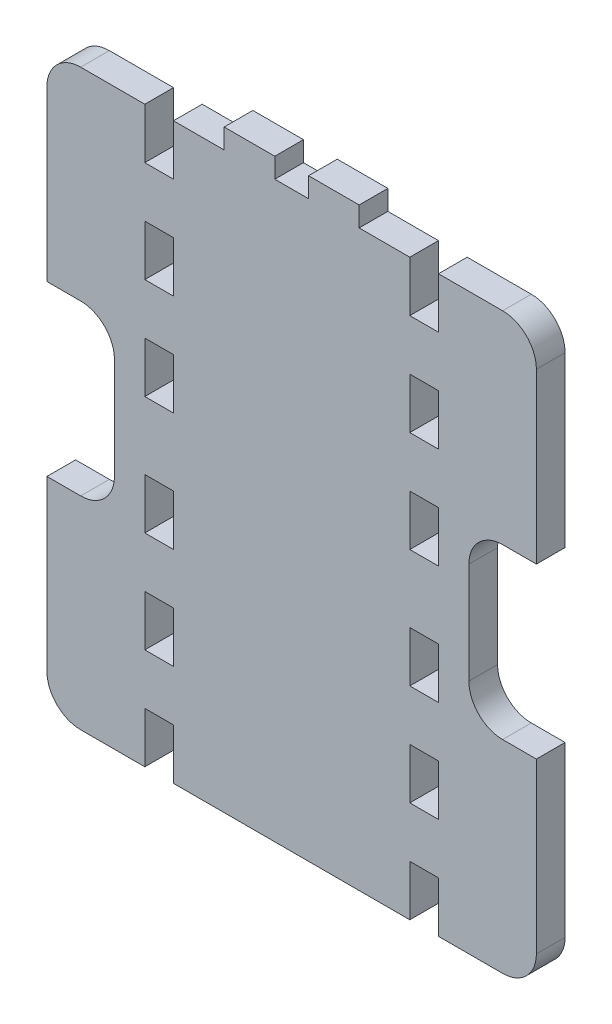
from build123d import *

# Parameters (mm, degrees)
SKETCH1_W           = 17
SKETCH1_H           = 30
BOSS_EXTRUDE1_DEPTH = 17


with BuildPart() as part:
    # Sketch1 → Boss-Extrude1 (new body)
    with BuildSketch(Plane.XY):
        with BuildLine():
            Line((-125, -170), (-87, -170))
            Line((-87, -170), (-87, -140))
            Line((-87, -140), (-70, -140))
            Line((-70, -140), (-70, -170))
            Line((-70, -170), (-40, -170))
            Line((-40, -170), (40, -170))
            Line((40, -170), (70, -170))
            Line((70, -170), (70, -140))
            Line((70, -140), (87, -140))
            Line((87, -140), (87, -170))
            Line((87, -170), (125, -170))
            ThreePointArc((125, -170), (139.142135624, -164.142135624), (145, -150))
            Line((145, -150), (145, -50))
            Line((145, -50), (125, -50))
            ThreePointArc((125, -50), (110.857864376, -44.142135624), (105, -30))
            Line((105, -30), (105, 0))
            Line((105, 0), (105, 30))
            ThreePointArc((105, 30), (110.857864376, 44.142135624), (125, 50))
            Line((125, 50), (145, 50))
            Line((145, 50), (145, 150))
            ThreePointArc((145, 150), (139.142135624, 164.142135624), (125, 170))
            Line((125, 170), (87, 170))
            Line((87, 170), (87, 140))
            Line((87, 140), (70, 140))
            Line((70, 140), (70, 170))
            Line((70, 170), (40, 170))
            Line((40, 170), (40, 181.8))
            Line((40, 181.8), (10, 181.8))
            Line((10, 181.8), (10, 170))
            Line((10, 170), (-10, 170))
            Line((-10, 170), (-10, 181.8))
            Line((-10, 181.8), (-40, 181.8))
            Line((-40, 181.8), (-40, 170))
            Line((-40, 170), (-70, 170))
            Line((-70, 170), (-70, 140))
            Line((-70, 140), (-87, 140))
            Line((-87, 140), (-87, 170))
            Line((-87, 170), (-125, 170))
            ThreePointArc((-125, 170), (-139.142135624, 164.142135624), (-145, 150))
            Line((-145, 150), (-145, 50))
            Line((-145, 50), (-125, 50))
            ThreePointArc((-125, 50), (-110.857864376, 44.142135624), (-105, 30))
            Line((-105, 30), (-105, 0))
            Line((-105, 0), (-105, -30))
            ThreePointArc((-105, -30), (-110.857864376, -44.142135624), (-125, -50))
            Line((-125, -50), (-145, -50))
            Line((-145, -50), (-145, -150))
            ThreePointArc((-145, -150), (-139.142135624, -164.142135624), (-125, -170))
        make_face()
        with Locations((-78.5, -95)):
            Rectangle(SKETCH1_W, SKETCH1_H, mode=Mode.SUBTRACT)
        with Locations((-78.5, -35)):
            Rectangle(SKETCH1_W, SKETCH1_H, mode=Mode.SUBTRACT)
        with Locations((-78.5, 35)):
            Rectangle(SKETCH1_W, SKETCH1_H, mode=Mode.SUBTRACT)
        with Locations((78.5, 95)):
            Rectangle(SKETCH1_W, SKETCH1_H, mode=Mode.SUBTRACT)
        with Locations((-78.5, 95)):
            Rectangle(SKETCH1_W, SKETCH1_H, mode=Mode.SUBTRACT)
        with Locations((78.5, 35)):
            Rectangle(SKETCH1_W, SKETCH1_H, mode=Mode.SUBTRACT)
        with Locations((78.5, -35)):
            Rectangle(SKETCH1_W, SKETCH1_H, mode=Mode.SUBTRACT)
        with Locations((78.5, -95)):
            Rectangle(SKETCH1_W, SKETCH1_H, mode=Mode.SUBTRACT)
    extrude(amount=BOSS_EXTRUDE1_DEPTH)


solid = part.part
